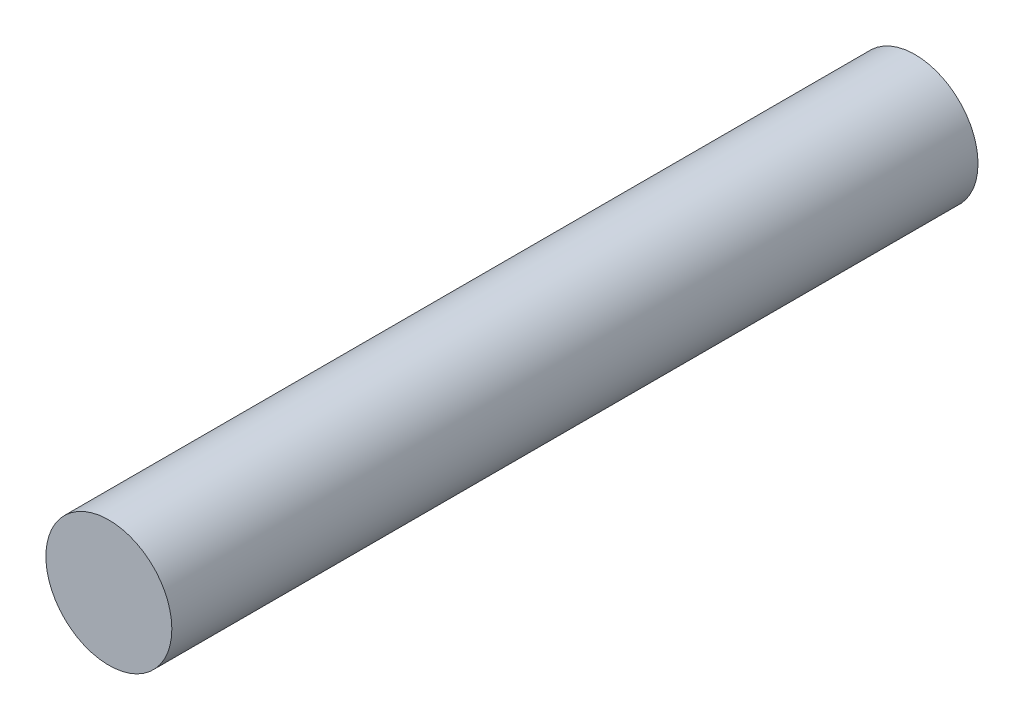
from build123d import *

# Parameters (mm, degrees)
SKETCH1_R      = 15.875
EXTRUDE1_DEPTH = 101.6


with BuildPart() as part:
    # Sketch1 → Extrude1 (new, symmetric)
    with BuildSketch(Plane.XY):
        Circle(SKETCH1_R)
    extrude(amount=EXTRUDE1_DEPTH, both=True)


solid = part.part
